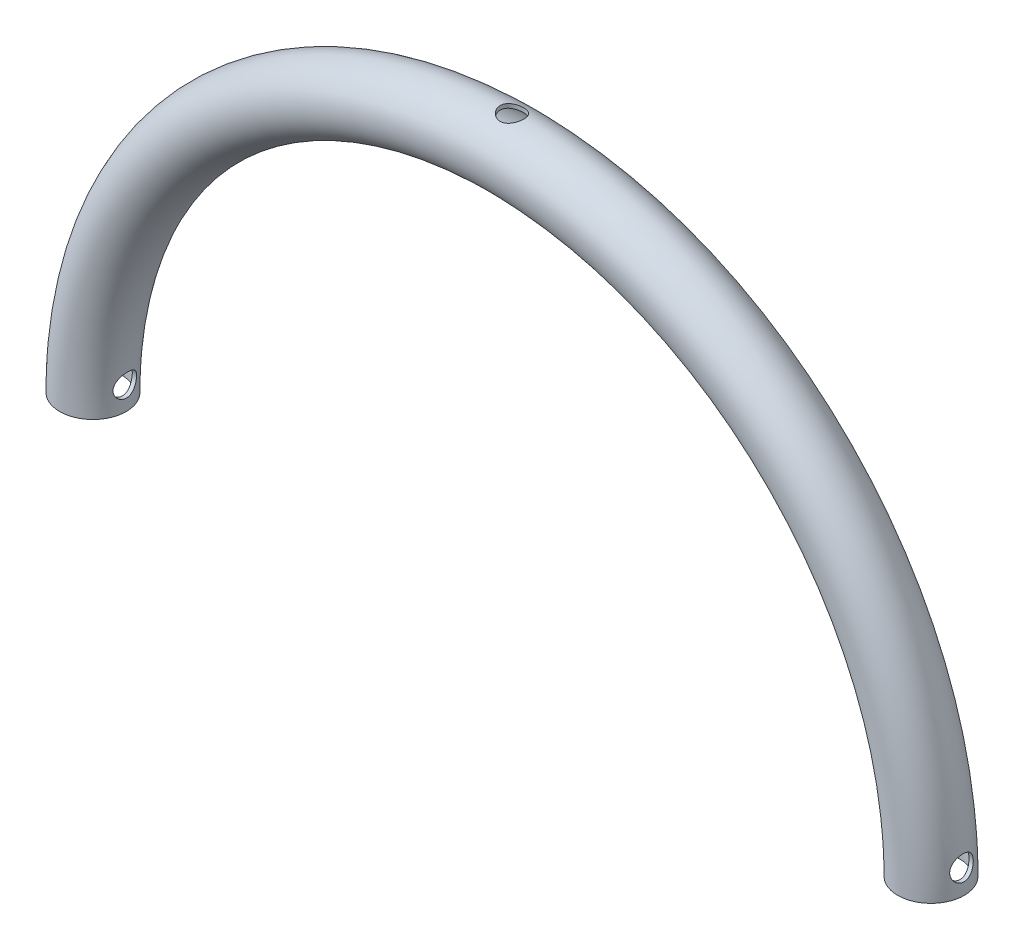
from build123d import *

# Parameters (mm, degrees)
SKETCH1_R               = 8.9662
SKETCH1_R_2             = 7.8994
CUT_EXTRUDE1_DEPTH      = 265.954298543
CUT_EXTRUDE1_DEPTH_BACK = 265.954298543
SKETCH3_R               = 3.175
CUT_EXTRUDE4_DEPTH      = 265.954298543
CUT_EXTRUDE4_DEPTH_BACK = 2.54
SKETCH6_R               = 3.175


with BuildPart() as part:
    # Sweep1: sweep along a path in Sketch2
    with BuildLine(Plane.XY) as sweep1_path:
        ThreePointArc((0, 0), (113.03, 113.03), (226.06, 0))
    # Sketch1 → Sweep1 (sweep)
    with BuildSketch(Plane(origin=(0, 0, 0), x_dir=(1, 0, 0), z_dir=(0, 1, 0))):
        Circle(SKETCH1_R)
        Circle(SKETCH1_R_2, mode=Mode.SUBTRACT)
    sweep(path=sweep1_path.line)

    # Sketch3 → Cut-Extrude1 (cut, two sides: drawn at the far end of the back side and taken through both)
    with BuildSketch(Plane(origin=(0, 0, 0), x_dir=(0, 0, -1), z_dir=(1, 0, 0)).offset(-CUT_EXTRUDE1_DEPTH_BACK)):
        with Locations(Location((0, 6.35, 0), (0, 0, 316.655916407))):
            Circle(SKETCH3_R)
    extrude(amount=CUT_EXTRUDE1_DEPTH + CUT_EXTRUDE1_DEPTH_BACK, mode=Mode.SUBTRACT)

    # Sketch6 → Cut-Extrude4 (cut, two sides: drawn at the far end of the back side and taken through both)
    with BuildSketch(Plane(origin=(0, 0, 0), x_dir=(1, 0, 0), z_dir=(0, 1, 0)).offset(-CUT_EXTRUDE4_DEPTH_BACK)):
        with Locations(Location((113.03, 0, 0), (0, 0, 133.524598996))):
            Circle(SKETCH6_R)
    extrude(amount=CUT_EXTRUDE4_DEPTH + CUT_EXTRUDE4_DEPTH_BACK, mode=Mode.SUBTRACT)


solid = part.part
